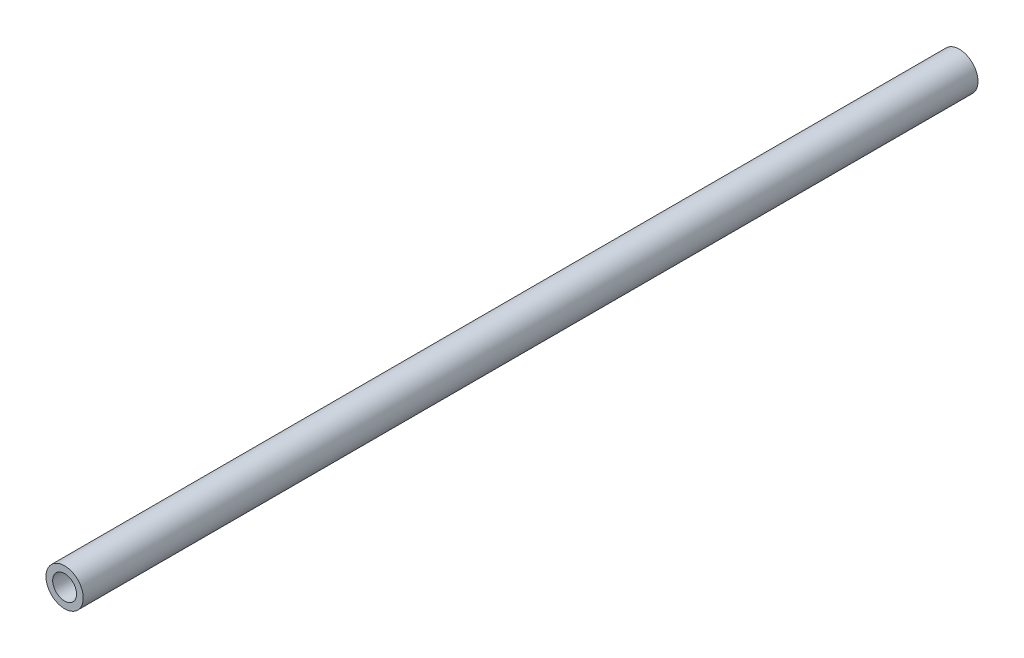
from build123d import *

# Parameters (mm, degrees)
SKETCH_1_R      = 2.5
SKETCH_1_R_2    = 1.6
EXTRUDE_1_DEPTH = 60


with BuildPart() as part:
    # 草图1 → 凸台-拉伸1 (new, symmetric)
    with BuildSketch(Plane.XY):
        Circle(SKETCH_1_R)
        Circle(SKETCH_1_R_2, mode=Mode.SUBTRACT)
    extrude(amount=EXTRUDE_1_DEPTH, both=True)


solid = part.part
